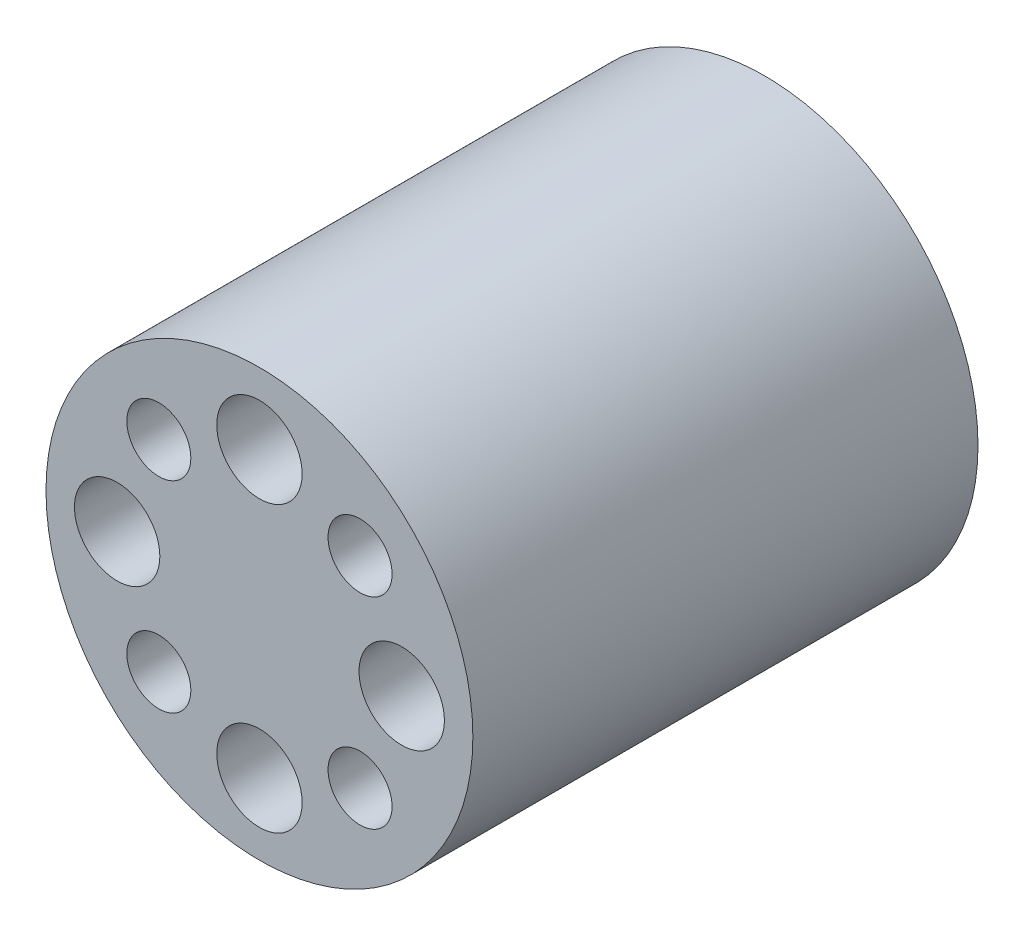
from build123d import *

# Parameters (mm, degrees)
SKIZZE1_R                       = 15
SKIZZE1_R_2                     = 1.65
AUFSATZ_LINEAR_AUSTRAGEN1_DEPTH = 35.5
SKIZZE4_R                       = 2.25
SCHNITT_LINEAR_AUSTRAGEN2_DEPTH = 10
SKIZZE3_R                       = 3
SCHNITT_LINEAR_AUSTRAGEN3_DEPTH = 29.5


with BuildPart() as part:
    # Skizze1 → Aufsatz-Linear austragen1 (new body)
    with BuildSketch(Plane.XY):
        Circle(SKIZZE1_R)
        with Locations((0, -10)):
            Circle(SKIZZE1_R_2, mode=Mode.SUBTRACT)
        with Locations((-10, 0)):
            Circle(SKIZZE1_R_2, mode=Mode.SUBTRACT)
        with Locations((0, 10)):
            Circle(SKIZZE1_R_2, mode=Mode.SUBTRACT)
        with Locations((10, 0)):
            Circle(SKIZZE1_R_2, mode=Mode.SUBTRACT)
    extrude(amount=AUFSATZ_LINEAR_AUSTRAGEN1_DEPTH)

    # Skizze4 → Schnitt-Linear austragen2 (cut)
    with BuildSketch(Plane.XY.offset(35.5)):
        with Locations((7.071067812, 7.071067812)):
            Circle(SKIZZE4_R)
        with Locations((7.071067812, -7.071067812)):
            Circle(SKIZZE4_R)
        with Locations((-7.071067812, -7.071067812)):
            Circle(SKIZZE4_R)
        with Locations((-7.071067812, 7.071067812)):
            Circle(SKIZZE4_R)
    extrude(amount=-SCHNITT_LINEAR_AUSTRAGEN2_DEPTH, mode=Mode.SUBTRACT)

    # Skizze3 → Schnitt-Linear austragen3 (cut)
    with BuildSketch(Plane.XY.offset(35.5)):
        with Locations((0, 10)):
            Circle(SKIZZE3_R)
        with Locations((10, 0)):
            Circle(SKIZZE3_R)
        with Locations((0, -10)):
            Circle(SKIZZE3_R)
        with Locations((-10, 0)):
            Circle(SKIZZE3_R)
    extrude(amount=-SCHNITT_LINEAR_AUSTRAGEN3_DEPTH, mode=Mode.SUBTRACT)


solid = part.part
